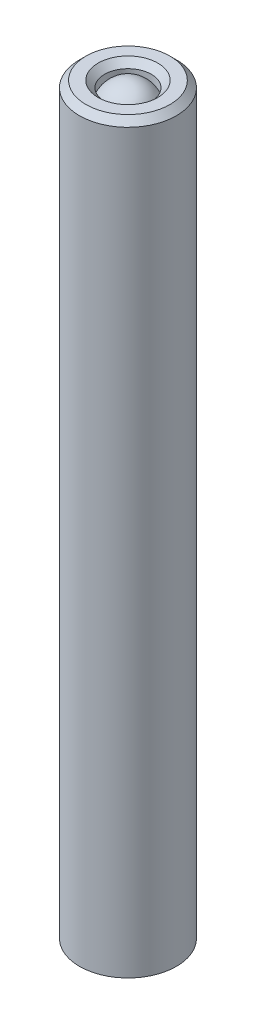
from build123d import *

# Parameters (mm, degrees)
SKETCH1_R           = 7.5
BOSS_EXTRUDE1_DEPTH = 115
CHAMFER1_SIZE       = 1


with BuildPart() as part:
    # Sketch1 → Boss-Extrude1 (new body)
    with BuildSketch(Plane(origin=(0, 0, 0), x_dir=(1, 0, 0), z_dir=(0, 1, 0))):
        with Locations(Location((0, 0, 0), (0, 0, 270))):
            Circle(SKETCH1_R)
    extrude(amount=BOSS_EXTRUDE1_DEPTH)

    # Sketch2 → Cut-Revolve1 (revolve, cut)
    with BuildSketch(Plane.XY, mode=Mode.PRIVATE) as cut_revolve1_sk:
        with BuildLine():
            Line((-3.618601574, 112.704618035), (-3.618601574, 116.762708117))
            Line((-3.618601574, 116.762708117), (0, 116.762708117))
            Line((0, 116.762708117), (0, 115))
            ThreePointArc((0, 115), (-2.142606807, 114.37775607), (-3.618601574, 112.704618035))
        make_face()
    revolve(cut_revolve1_sk.sketch.rotate(Axis((0, 125.515236919, 0), (0, -1, 0)), 270), axis=Axis((0, 125.515236919, 0), (0, -1, 0)), mode=Mode.SUBTRACT)

    # Chamfer1
    chamfer1_edges = [part.edges().sort_by_distance(p)[0] for p in [
        (0, 115, -7.5),
        (0, 115, -3.618601574),
    ]]
    chamfer(chamfer1_edges, length=CHAMFER1_SIZE)


solid = part.part
